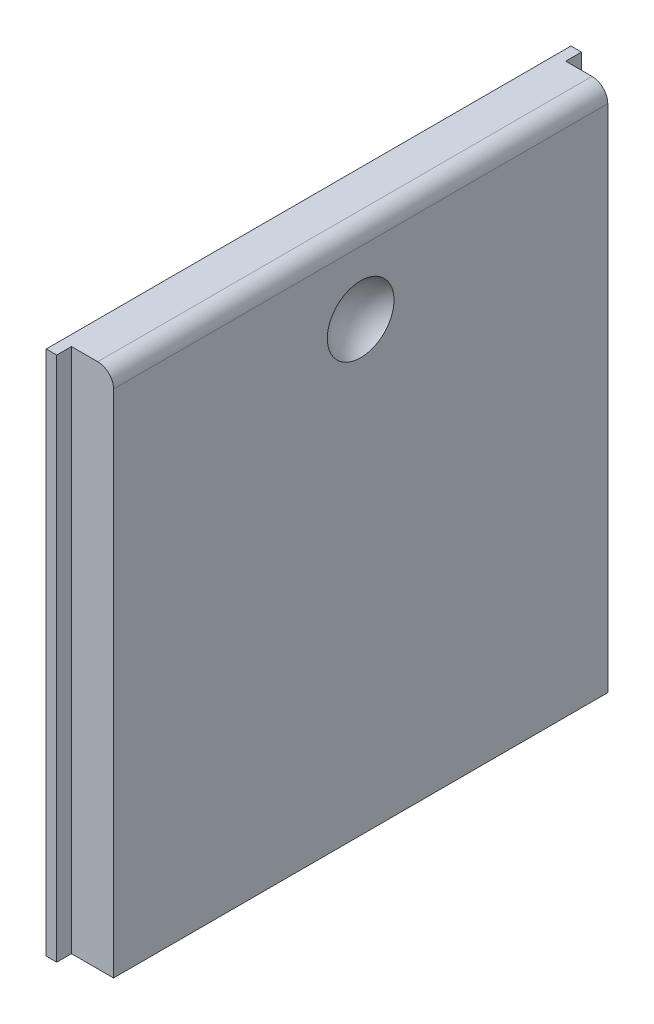
from build123d import *

# Parameters (mm, degrees)
BOSS_EXTRUDE1_DEPTH = 100
FILLET2_R           = 3


with BuildPart() as part:
    # Sketch2 → Boss-Extrude1 (new body)
    with BuildSketch(Plane(origin=(0, 0, 0), x_dir=(1, 0, 0), z_dir=(0, 1, 0))):
        Polygon((0, -47), (-8, -47), (-8, -49.8), (-10, -49.8), (-10, -47.4), (-10, 47.6), (-10, 50), (-8, 50), (-8, 47), (0, 47), align=None)
    extrude(amount=BOSS_EXTRUDE1_DEPTH)

    # Fillet2
    fillet2_edges = [part.edges().sort_by_distance(p)[0] for p in [
        (0, 100, 0),
    ]]
    fillet(fillet2_edges, radius=FILLET2_R)

    # Sketch3 → Cut-Revolve1 (revolve, cut)
    with BuildSketch(Plane.XY):
        with BuildLine():
            Line((-3.5, 85), (11.5, 85))
            ThreePointArc((11.5, 85), (4, 92.5), (-3.5, 85))
        make_face()
    revolve(axis=Axis((-3.5, 85, 0), (1, 0, 0)), mode=Mode.SUBTRACT)


solid = part.part
